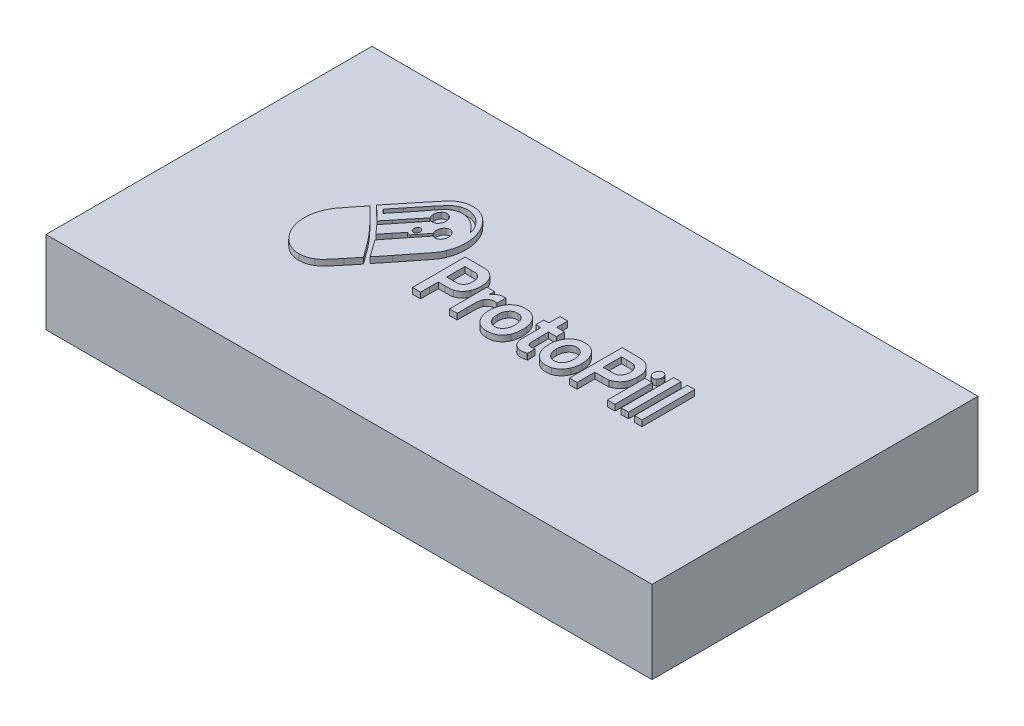
from build123d import *

# Parameters (mm, degrees)
SKETCH1_W           = 308.387151948
SKETCH1_H           = 165.840381384
BOSS_EXTRUDE1_DEPTH = 42
BOSS_EXTRUDE2_DEPTH = 3


with BuildPart() as part:
    # Sketch1 → Boss-Extrude1 (new body)
    with BuildSketch(Plane(origin=(0, 0, 0), x_dir=(1, 0, 0), z_dir=(0, 1, 0))):
        Rectangle(SKETCH1_W, SKETCH1_H)
    extrude(amount=BOSS_EXTRUDE1_DEPTH)

    # Sketch5 → Boss-Extrude2 (add)
    # profile 1 of 13: a face of its own
    with BuildSketch(Plane(origin=(0, 42, 0), x_dir=(1, 0, 0), z_dir=(0, 1, 0))):
        with BuildLine():
            add(Edge.make_bspline(
                [(-70.434889142, 22.994330596), (-74.068365142, 18.491741596), (-77.713638142, 13.989151596), (-78.539428142, 12.987008596)],
                knots=[0, 0, 0, 0, 1, 1, 1, 1], degree=3))
            Line((-78.539428142, 12.987008596), (-80.037647142, 11.137982596))
            Line((-80.037647142, 11.137982596), (-78.126533142, 9.303071596))
            add(Edge.make_bspline(
                [(-78.126533142, 9.303071596), (-77.076600142, 8.300927596), (-75.507599142, 6.762425596), (-74.634621142, 5.887313596)],
                knots=[0, 0, 0, 0, 1, 1, 1, 1], degree=3))
            add(Edge.make_bspline(
                [(-74.634621142, 5.887313596), (-73.761643142, 5.012202596), (-72.994838142, 4.320582596), (-72.924056142, 4.334696596)],
                knots=[0, 0, 0, 0, 1, 1, 1, 1], degree=3))
            add(Edge.make_bspline(
                [(-72.924056142, 4.334696596), (-72.841477142, 4.362926596), (-71.284273142, 6.254296596), (-69.443941142, 8.540877596)],
                knots=[0, 0, 0, 0, 1, 1, 1, 1], degree=3))
            add(Edge.make_bspline(
                [(-69.443941142, 8.540877596), (-67.591812142, 10.827458596), (-64.902096142, 14.144413596), (-63.439268142, 15.894636596)],
                knots=[0, 0, 0, 0, 1, 1, 1, 1], degree=3))
            Line((-63.439268142, 15.894636596), (-60.796740142, 19.084558596))
            Line((-60.796740142, 19.084558596), (-61.127056142, 19.776178596))
            add(Edge.make_bspline(
                [(-61.127056142, 19.776178596), (-61.421981142, 20.383110596), (-61.469169142, 20.608946596), (-61.469169142, 21.596975596)],
                knots=[0, 0, 0, 0, 1, 1, 1, 1], degree=3))
            add(Edge.make_bspline(
                [(-61.469169142, 21.596975596), (-61.469169142, 22.923756596), (-61.233229142, 23.573033596), (-60.466424142, 24.405800596)],
                knots=[0, 0, 0, 0, 1, 1, 1, 1], degree=3))
            add(Edge.make_bspline(
                [(-60.466424142, 24.405800596), (-59.805792142, 25.125650596), (-59.251333142, 25.379714596), (-58.401949142, 25.379714596)],
                knots=[0, 0, 0, 0, 1, 1, 1, 1], degree=3))
            add(Edge.make_bspline(
                [(-58.401949142, 25.379714596), (-57.517174142, 25.393829596), (-56.797557142, 25.026847596), (-56.136925142, 24.222309596)],
                knots=[0, 0, 0, 0, 1, 1, 1, 1], degree=3))
            add(Edge.make_bspline(
                [(-56.136925142, 24.222309596), (-55.452699142, 23.389541596), (-55.228556142, 22.641462596), (-55.299338142, 21.314681596)],
                knots=[0, 0, 0, 0, 1, 1, 1, 1], degree=3))
            add(Edge.make_bspline(
                [(-55.299338142, 21.314681596), (-55.346526142, 20.467799596), (-55.417308142, 20.143160596), (-55.688639142, 19.677375596)],
                knots=[0, 0, 0, 0, 1, 1, 1, 1], degree=3))
            add(Edge.make_bspline(
                [(-55.688639142, 19.677375596), (-56.396459142, 18.378823596), (-57.210452142, 17.828350596), (-58.401949142, 17.842464596)],
                knots=[0, 0, 0, 0, 1, 1, 1, 1], degree=3))
            Line((-58.401949142, 17.842464596), (-59.145160142, 17.842464596))
            Line((-59.145160142, 17.842464596), (-60.666973142, 15.922865596))
            add(Edge.make_bspline(
                [(-60.666973142, 15.922865596), (-61.492763142, 14.864263596), (-64.229667142, 11.448505596), (-66.742428142, 8.343271596)],
                knots=[0, 0, 0, 0, 1, 1, 1, 1], degree=3))
            add(Edge.make_bspline(
                [(-66.742428142, 8.343271596), (-69.266986142, 5.238037596), (-71.319664142, 2.655047596), (-71.319664142, 2.612703596)],
                knots=[0, 0, 0, 0, 1, 1, 1, 1], degree=3))
            add(Edge.make_bspline(
                [(-71.319664142, 2.612703596), (-71.319664142, 2.556244596), (-70.706220142, 1.836394596), (-69.951212142, 1.003627596)],
                knots=[0, 0, 0, 0, 1, 1, 1, 1], degree=3))
            Line((-69.951212142, 1.003627596), (-68.570963142, -0.534874404))
            Line((-68.570963142, -0.534874404), (-67.308684142, -1.889885404))
            add(Edge.make_bspline(
                [(-63.757787142, 2.612703596), (-65.704292142, 0.184975596), (-67.308684142, -1.833426404), (-67.308684142, -1.889885404)],
                knots=[0, 0, 0, 0, 1, 1, 1, 1], degree=3))
            add(Edge.make_bspline(
                [(-60.006341142, 6.917687596), (-60.147905142, 6.974145596), (-61.138853142, 5.844969596), (-63.757787142, 2.612703596)],
                knots=[0, 0, 0, 0, 1, 1, 1, 1], degree=3))
            add(Edge.make_bspline(
                [(-59.133363142, 6.649507596), (-59.510867142, 6.748310596), (-59.900168142, 6.861228596), (-60.006341142, 6.917687596)],
                knots=[0, 0, 0, 0, 1, 1, 1, 1], degree=3))
            Line((-59.133363142, 6.649507596), (-58.449137142, 6.480131596))
            Line((-58.449137142, 6.480131596), (-55.570669142, 10.065265596))
            Line((-55.570669142, 10.065265596), (-54.402766142, 11.561423596))
            Line((-54.402766142, 11.561423596), (-53.246660142, 13.071696596))
            Line((-53.246660142, 13.071696596), (-53.494397142, 13.763316596))
            add(Edge.make_bspline(
                [(-53.494397142, 13.763316596), (-54.143232142, 15.569998596), (-53.541585142, 17.673088596), (-52.102351142, 18.604658596)],
                knots=[0, 0, 0, 0, 1, 1, 1, 1], degree=3))
            add(Edge.make_bspline(
                [(-52.102351142, 18.604658596), (-50.875463142, 19.409196596), (-49.577793142, 19.197476596), (-48.527860142, 18.040070596)],
                knots=[0, 0, 0, 0, 1, 1, 1, 1], degree=3))
            add(Edge.make_bspline(
                [(-48.527860142, 18.040070596), (-46.864483142, 16.162815596), (-47.395348142, 12.789402596), (-49.542402142, 11.716684596)],
                knots=[0, 0, 0, 0, 1, 1, 1, 1], degree=3))
            add(Edge.make_bspline(
                [(-49.542402142, 11.716684596), (-50.037876142, 11.462620596), (-51.005230142, 11.448505596), (-51.618674142, 11.660226596)],
                knots=[0, 0, 0, 0, 1, 1, 1, 1], degree=3))
            Line((-51.618674142, 11.660226596), (-52.055163142, 11.815487596))
            Line((-52.055163142, 11.815487596), (-53.057908142, 10.573394596))
            add(Edge.make_bspline(
                [(-53.057908142, 10.573394596), (-53.966277142, 9.430103596), (-57.493580142, 4.983973596), (-62.967388142, -1.889885404)],
                knots=[0, 0, 0, 0, 1, 1, 1, 1], degree=3))
            add(Edge.make_bspline(
                [(-62.967388142, -1.889885404), (-64.123494142, -3.329585404), (-65.067254142, -4.571678404), (-65.067254142, -4.628137404)],
                knots=[0, 0, 0, 0, 1, 1, 1, 1], degree=3))
            add(Edge.make_bspline(
                [(-65.067254142, -4.628137404), (-65.067254142, -4.698711404), (-64.359434142, -5.714969404), (-63.498253142, -6.886489404)],
                knots=[0, 0, 0, 0, 1, 1, 1, 1], degree=3))
            add(Edge.make_bspline(
                [(-63.498253142, -6.886489404), (-62.637072142, -8.072124404), (-61.268620142, -9.949379404), (-60.478221142, -11.078555404)],
                knots=[0, 0, 0, 0, 1, 1, 1, 1], degree=3))
            add(Edge.make_bspline(
                [(-60.478221142, -11.078555404), (-59.676025142, -12.207731404), (-58.980002142, -13.167531404), (-58.944611142, -13.223989404)],
                knots=[0, 0, 0, 0, 1, 1, 1, 1], degree=3))
            add(Edge.make_bspline(
                [(-58.944611142, -13.223989404), (-58.897423142, -13.294563404), (-56.573414142, -10.457508404), (-53.789322142, -6.942948404)],
                knots=[0, 0, 0, 0, 1, 1, 1, 1], degree=3))
            add(Edge.make_bspline(
                [(-53.789322142, -6.942948404), (-42.983270142, 6.635393596), (-43.348977142, 6.127263596), (-42.192871142, 8.921974596)],
                knots=[0, 0, 0, 0, 1, 1, 1, 1], degree=3))
            add(Edge.make_bspline(
                [(-42.192871142, 8.921974596), (-39.703704142, 14.892492596), (-40.069411142, 21.653433596), (-43.195616142, 27.412231596)],
                knots=[0, 0, 0, 0, 1, 1, 1, 1], degree=3))
            add(Edge.make_bspline(
                [(-43.195616142, 27.412231596), (-44.363519142, 29.571780596), (-46.569558142, 31.985394596), (-48.445281142, 33.171028596)],
                knots=[0, 0, 0, 0, 1, 1, 1, 1], degree=3))
            add(Edge.make_bspline(
                [(-48.445281142, 33.171028596), (-49.483417142, 33.820305596), (-51.429922142, 34.582498596), (-52.727592142, 34.864793596)],
                knots=[0, 0, 0, 0, 1, 1, 1, 1], degree=3))
            add(Edge.make_bspline(
                [(-52.727592142, 34.864793596), (-54.001668142, 35.118857596), (-55.948173142, 35.118857596), (-57.222249142, 34.836563596)],
                knots=[0, 0, 0, 0, 1, 1, 1, 1], degree=3))
            add(Edge.make_bspline(
                [(-57.222249142, 34.836563596), (-59.227739142, 34.413122596), (-61.528154142, 33.227487596), (-63.061764142, 31.844247596)],
                knots=[0, 0, 0, 0, 1, 1, 1, 1], degree=3))
            add(Edge.make_bspline(
                [(-63.061764142, 31.844247596), (-63.486456142, 31.463150596), (-66.801413142, 27.482804596), (-70.434889142, 22.994330596)],
                knots=[0, 0, 0, 0, 1, 1, 1, 1], degree=3))
        make_face()
        with BuildLine():
            add(Edge.make_bspline(
                [(-57.859287142, 11.886061596), (-58.354761142, 12.281273596), (-58.980002142, 12.309502596), (-59.487273142, 11.928405596)],
                knots=[0, 0, 0, 0, 1, 1, 1, 1], degree=3))
            add(Edge.make_bspline(
                [(-57.163264142, 10.305214596), (-57.163264142, 11.039179596), (-57.363813142, 11.490849596), (-57.859287142, 11.886061596)],
                knots=[0, 0, 0, 0, 1, 1, 1, 1], degree=3))
            add(Edge.make_bspline(
                [(-59.345709142, 8.625565596), (-58.331167142, 8.046862596), (-57.163264142, 8.950203596), (-57.163264142, 10.305214596)],
                knots=[0, 0, 0, 0, 1, 1, 1, 1], degree=3))
            add(Edge.make_bspline(
                [(-59.487273142, 11.928405596), (-60.537206142, 11.166211596), (-60.454627142, 9.246612596), (-59.345709142, 8.625565596)],
                knots=[0, 0, 0, 0, 1, 1, 1, 1], degree=3))
        make_face(mode=Mode.SUBTRACT)
        with BuildLine():
            add(Edge.make_bspline(
                [(-63.628020142, 23.050789596), (-65.491946142, 20.510143596), (-66.612661142, 19.098673596), (-72.463973142, 11.886061596)],
                knots=[0, 0, 0, 0, 1, 1, 1, 1], degree=3))
            Line((-72.463973142, 11.886061596), (-74.728997142, 9.077236596))
            Line((-74.728997142, 9.077236596), (-75.625569142, 10.051150596))
            add(Edge.make_bspline(
                [(-75.625569142, 10.051150596), (-76.109246142, 10.573394596), (-76.510344142, 11.039179596), (-76.510344142, 11.081523596)],
                knots=[0, 0, 0, 0, 1, 1, 1, 1], degree=3))
            add(Edge.make_bspline(
                [(-76.510344142, 11.081523596), (-76.510344142, 11.123867596), (-74.481260142, 13.650398596), (-71.992093142, 16.670944596)],
                knots=[0, 0, 0, 0, 1, 1, 1, 1], degree=3))
            add(Edge.make_bspline(
                [(-71.992093142, 16.670944596), (-69.514723142, 19.705605596), (-66.317736142, 23.629491596), (-64.890299142, 25.393829596)],
                knots=[0, 0, 0, 0, 1, 1, 1, 1], degree=3))
            add(Edge.make_bspline(
                [(-64.890299142, 25.393829596), (-61.563545142, 29.515321596), (-60.537206142, 30.461006596), (-58.342964142, 31.420806596)],
                knots=[0, 0, 0, 0, 1, 1, 1, 1], degree=3))
            add(Edge.make_bspline(
                [(-58.342964142, 31.420806596), (-56.420053142, 32.253573596), (-54.390969142, 32.422949596), (-52.267509142, 31.900705596)],
                knots=[0, 0, 0, 0, 1, 1, 1, 1], degree=3))
            add(Edge.make_bspline(
                [(-52.267509142, 31.900705596), (-49.719357142, 31.265544596), (-47.442536142, 29.557665596), (-45.696580142, 26.932331596)],
                knots=[0, 0, 0, 0, 1, 1, 1, 1], degree=3))
            add(Edge.make_bspline(
                [(-45.696580142, 26.932331596), (-44.764617142, 25.534976596), (-43.785466142, 23.079018596), (-44.151173142, 23.079018596)],
                knots=[0, 0, 0, 0, 1, 1, 1, 1], degree=3))
            add(Edge.make_bspline(
                [(-44.151173142, 23.079018596), (-44.198361142, 23.079018596), (-44.717429142, 23.671835596), (-45.319076142, 24.405800596)],
                knots=[0, 0, 0, 0, 1, 1, 1, 1], degree=3))
            add(Edge.make_bspline(
                [(-45.319076142, 24.405800596), (-48.575048142, 28.357916596), (-53.057908142, 30.079909596), (-56.986309142, 28.866045596)],
                knots=[0, 0, 0, 0, 1, 1, 1, 1], degree=3))
            add(Edge.make_bspline(
                [(-56.986309142, 28.866045596), (-58.236791142, 28.484948596), (-59.888371142, 27.496919596), (-60.843928142, 26.537120596)],
                knots=[0, 0, 0, 0, 1, 1, 1, 1], degree=3))
            add(Edge.make_bspline(
                [(-60.843928142, 26.537120596), (-61.280417142, 26.113679596), (-62.530899142, 24.546947596), (-63.628020142, 23.050789596)],
                knots=[0, 0, 0, 0, 1, 1, 1, 1], degree=3))
        make_face(mode=Mode.SUBTRACT)
    # profile 2 of 13: a face of its own
    with BuildSketch(Plane(origin=(0, 42, 0), x_dir=(1, 0, 0), z_dir=(0, 1, 0))):
        with BuildLine():
            Line((-34.630994142, 10.799229596), (-34.630994142, -2.609735404))
            Line((-34.630994142, -2.609735404), (-34.630994142, -16.018700404))
            Line((-34.630994142, -16.018700404), (-32.566519142, -16.018700404))
            Line((-32.566519142, -16.018700404), (-30.502044142, -16.018700404))
            Line((-30.502044142, -16.018700404), (-30.478450142, -11.530225404))
            Line((-30.478450142, -11.530225404), (-30.443059142, -7.055865404))
            Line((-30.443059142, -7.055865404), (-27.139899142, -7.041751404))
            add(Edge.make_bspline(
                [(-27.139899142, -7.041751404), (-24.167055142, -7.027636404), (-23.742363142, -6.999407404), (-22.916573142, -6.731227404)],
                knots=[0, 0, 0, 0, 1, 1, 1, 1], degree=3))
            add(Edge.make_bspline(
                [(-22.916573142, -6.731227404), (-20.887489142, -6.067836404), (-19.353879142, -4.599908404), (-18.480901142, -2.468588404)],
                knots=[0, 0, 0, 0, 1, 1, 1, 1], degree=3))
            add(Edge.make_bspline(
                [(-18.480901142, -2.468588404), (-17.820269142, -0.845397404), (-17.607923142, 0.439039596), (-17.678705142, 2.400983596)],
                knots=[0, 0, 0, 0, 1, 1, 1, 1], degree=3))
            add(Edge.make_bspline(
                [(-17.678705142, 2.400983596), (-17.808472142, 5.915543596), (-19.129736142, 8.498533596), (-21.477339142, 9.895888596)],
                knots=[0, 0, 0, 0, 1, 1, 1, 1], degree=3))
            add(Edge.make_bspline(
                [(-21.477339142, 9.895888596), (-22.928370142, 10.742770596), (-23.341265142, 10.799229596), (-29.286953142, 10.799229596)],
                knots=[0, 0, 0, 0, 1, 1, 1, 1], degree=3))
            Line((-29.286953142, 10.799229596), (-34.630994142, 10.799229596))
        make_face()
        with BuildLine():
            add(Edge.make_bspline(
                [(-22.078986142, -0.224351404), (-22.444693142, -1.155921404), (-22.999152142, -1.833426404), (-23.754160142, -2.285097404)],
                knots=[0, 0, 0, 0, 1, 1, 1, 1], degree=3))
            Line((-23.754160142, -2.285097404), (-24.426589142, -2.680309404))
            Line((-24.426589142, -2.680309404), (-27.458418142, -2.722653404))
            Line((-27.458418142, -2.722653404), (-30.502044142, -2.764997404))
            Line((-30.502044142, -2.764997404), (-30.502044142, 1.906968596))
            Line((-30.502044142, 1.906968596), (-30.502044142, 6.593048596))
            Line((-30.502044142, 6.593048596), (-27.517403142, 6.536590596))
            add(Edge.make_bspline(
                [(-27.517403142, 6.536590596), (-25.051830142, 6.480131596), (-24.450183142, 6.437787596), (-24.001897142, 6.226066596)],
                knots=[0, 0, 0, 0, 1, 1, 1, 1], degree=3))
            add(Edge.make_bspline(
                [(-24.001897142, 6.226066596), (-23.258686142, 5.901428596), (-22.539069142, 5.125120596), (-22.149768142, 4.250008596)],
                knots=[0, 0, 0, 0, 1, 1, 1, 1], degree=3))
            add(Edge.make_bspline(
                [(-22.149768142, 4.250008596), (-21.854843142, 3.600732596), (-21.831249142, 3.389011596), (-21.831249142, 1.977541596)],
                knots=[0, 0, 0, 0, 1, 1, 1, 1], degree=3))
            add(Edge.make_bspline(
                [(-21.831249142, 1.977541596), (-21.831249142, 0.693104596), (-21.878437142, 0.312007596), (-22.078986142, -0.224351404)],
                knots=[0, 0, 0, 0, 1, 1, 1, 1], degree=3))
        make_face(mode=Mode.SUBTRACT)
    # profile 3 of 13: a face of its own
    with BuildSketch(Plane(origin=(0, 42, 0), x_dir=(1, 0, 0), z_dir=(0, 1, 0))):
        with BuildLine():
            Line((45.234695858, 10.813344596), (45.234695858, -2.595620404))
            Line((45.234695858, -2.595620404), (45.234695858, -16.018700404))
            Line((45.234695858, -16.018700404), (47.181200858, -16.018700404))
            Line((47.181200858, -16.018700404), (49.127705858, -16.018700404))
            Line((49.127705858, -16.018700404), (49.127705858, -11.516111404))
            Line((49.127705858, -11.516111404), (49.127705858, -7.013521404))
            Line((49.127705858, -7.013521404), (52.643211858, -6.957063404))
            Line((52.643211858, -6.957063404), (56.146920858, -6.900604404))
            Line((56.146920858, -6.900604404), (57.255838858, -6.448933404))
            add(Edge.make_bspline(
                [(57.255838858, -6.448933404), (60.464622858, -5.122152404), (62.151593858, -2.214523404), (62.151593858, 1.977541596)],
                knots=[0, 0, 0, 0, 1, 1, 1, 1], degree=3))
            add(Edge.make_bspline(
                [(62.151593858, 1.977541596), (62.151593858, 4.631105596), (61.490961858, 6.593048596), (60.051727858, 8.230354596)],
                knots=[0, 0, 0, 0, 1, 1, 1, 1], degree=3))
            add(Edge.make_bspline(
                [(60.051727858, 8.230354596), (59.072576858, 9.331300596), (58.117019858, 9.980576596), (56.831146858, 10.404017596)],
                knots=[0, 0, 0, 0, 1, 1, 1, 1], degree=3))
            add(Edge.make_bspline(
                [(56.831146858, 10.404017596), (55.958168858, 10.700426596), (55.604258858, 10.714541596), (50.578736858, 10.771000596)],
                knots=[0, 0, 0, 0, 1, 1, 1, 1], degree=3))
            Line((50.578736858, 10.771000596), (45.234695858, 10.813344596))
        make_face()
        with BuildLine():
            add(Edge.make_bspline(
                [(56.052544858, -2.341556404), (55.462694858, -2.666194404), (55.297536858, -2.680309404), (52.289301858, -2.722653404)],
                knots=[0, 0, 0, 0, 1, 1, 1, 1], degree=3))
            Line((52.289301858, -2.722653404), (49.127705858, -2.764997404))
            Line((49.127705858, -2.764997404), (49.127705858, 1.892853596))
            Line((49.127705858, 1.892853596), (49.127705858, 6.564819596))
            Line((49.127705858, 6.564819596), (51.746639858, 6.564819596))
            add(Edge.make_bspline(
                [(51.746639858, 6.564819596), (53.185873858, 6.564819596), (54.695889858, 6.494246596), (55.096987858, 6.409557596)],
                knots=[0, 0, 0, 0, 1, 1, 1, 1], degree=3))
            add(Edge.make_bspline(
                [(55.096987858, 6.409557596), (56.571612858, 6.099034596), (57.668733858, 4.913399596), (58.034440858, 3.247865596)],
                knots=[0, 0, 0, 0, 1, 1, 1, 1], degree=3))
            add(Edge.make_bspline(
                [(58.034440858, 3.247865596), (58.270380858, 2.118689596), (58.258583858, 1.412954596), (57.963658858, 0.283777596)],
                knots=[0, 0, 0, 0, 1, 1, 1, 1], degree=3))
            add(Edge.make_bspline(
                [(57.963658858, 0.283777596), (57.668733858, -0.887742404), (56.960913858, -1.861656404), (56.052544858, -2.341556404)],
                knots=[0, 0, 0, 0, 1, 1, 1, 1], degree=3))
        make_face(mode=Mode.SUBTRACT)
    # profile 4 of 13: a face of its own
    with BuildSketch(Plane(origin=(0, 42, 0), x_dir=(1, 0, 0), z_dir=(0, 1, 0))):
        with BuildLine():
            add(Edge.make_bspline(
                [(73.783435858, 10.714541596), (72.969442858, 10.728656596), (72.131855858, 10.714541596), (71.931306858, 10.686311596)],
                knots=[0, 0, 0, 0, 1, 1, 1, 1], degree=3))
            Line((71.931306858, 10.686311596), (71.542005858, 10.643967596))
            Line((71.542005858, 10.643967596), (71.542005858, -2.694423404))
            Line((71.542005858, -2.694423404), (71.542005858, -16.032815404))
            Line((71.542005858, -16.032815404), (73.405931858, -15.990471404))
            Line((73.405931858, -15.990471404), (75.258060858, -15.948126404))
            Line((75.258060858, -15.948126404), (75.258060858, -2.623850404))
            Line((75.258060858, -2.623850404), (75.258060858, 10.700426596))
            Line((75.258060858, 10.700426596), (73.783435858, 10.714541596))
        make_face()
    # profile 5 of 13: a face of its own
    with BuildSketch(Plane(origin=(0, 42, 0), x_dir=(1, 0, 0), z_dir=(0, 1, 0))):
        with BuildLine():
            add(Edge.make_bspline(
                [(78.455047858, 10.686311596), (78.419656858, 10.643967596), (78.384265858, 4.616990596), (78.384265858, -2.708538404)],
                knots=[0, 0, 0, 0, 1, 1, 1, 1], degree=3))
            Line((78.384265858, -2.708538404), (78.384265858, -16.018700404))
            Line((78.384265858, -16.018700404), (80.271785858, -16.018700404))
            Line((80.271785858, -16.018700404), (82.159305858, -16.018700404))
            Line((82.159305858, -16.018700404), (82.159305858, -2.609735404))
            Line((82.159305858, -2.609735404), (82.159305858, 10.813344596))
            Line((82.159305858, 10.813344596), (80.342567858, 10.785114596))
            add(Edge.make_bspline(
                [(80.342567858, 10.785114596), (79.339822858, 10.785114596), (78.490438858, 10.742770596), (78.455047858, 10.686311596)],
                knots=[0, 0, 0, 0, 1, 1, 1, 1], degree=3))
        make_face()
    # profile 6 of 13: a face of its own
    with BuildSketch(Plane(origin=(0, 42, 0), x_dir=(1, 0, 0), z_dir=(0, 1, 0))):
        with BuildLine():
            add(Edge.make_bspline(
                [(-72.074672142, -28.213801404), (-70.175355142, -27.056395404), (-69.420347142, -26.265972404), (-64.784126142, -20.605978404)],
                knots=[0, 0, 0, 0, 1, 1, 1, 1], degree=3))
            Line((-64.784126142, -20.605978404), (-60.372048142, -15.228277404))
            Line((-60.372048142, -15.228277404), (-61.681515142, -13.393366404))
            add(Edge.make_bspline(
                [(-61.681515142, -13.393366404), (-66.058202142, -7.267586404), (-68.146271142, -4.628137404), (-71.673574142, -0.774824404)],
                knots=[0, 0, 0, 0, 1, 1, 1, 1], degree=3))
            add(Edge.make_bspline(
                [(-71.673574142, -0.774824404), (-74.752591142, 2.598588596), (-80.934219142, 8.893745596), (-81.347114142, 9.077236596)],
                knots=[0, 0, 0, 0, 1, 1, 1, 1], degree=3))
            add(Edge.make_bspline(
                [(-81.347114142, 9.077236596), (-81.394302142, 9.091350596), (-83.069476142, 7.044719596), (-85.074966142, 4.504073596)],
                knots=[0, 0, 0, 0, 1, 1, 1, 1], degree=3))
            add(Edge.make_bspline(
                [(-85.074966142, 4.504073596), (-87.080456142, 1.963427596), (-88.944382142, -0.436071404), (-89.227510142, -0.831283404)],
                knots=[0, 0, 0, 0, 1, 1, 1, 1], degree=3))
            add(Edge.make_bspline(
                [(-89.227510142, -0.831283404), (-90.430804142, -2.539161404), (-91.634098142, -5.192725404), (-92.259339142, -7.479306404)],
                knots=[0, 0, 0, 0, 1, 1, 1, 1], degree=3))
            add(Edge.make_bspline(
                [(-92.259339142, -7.479306404), (-93.144114142, -10.753917404), (-93.120520142, -14.720148404), (-92.200354142, -18.022987404)],
                knots=[0, 0, 0, 0, 1, 1, 1, 1], degree=3))
            add(Edge.make_bspline(
                [(-92.200354142, -18.022987404), (-91.492534142, -20.563633404), (-90.466195142, -22.567921404), (-88.861803142, -24.572208404)],
                knots=[0, 0, 0, 0, 1, 1, 1, 1], degree=3))
            add(Edge.make_bspline(
                [(-88.861803142, -24.572208404), (-85.900756142, -28.284374404), (-82.491423142, -30.048712404), (-78.338879142, -30.034597404)],
                knots=[0, 0, 0, 0, 1, 1, 1, 1], degree=3))
            add(Edge.make_bspline(
                [(-78.338879142, -30.034597404), (-75.991276142, -30.020482404), (-74.174538142, -29.498238404), (-72.074672142, -28.213801404)],
                knots=[0, 0, 0, 0, 1, 1, 1, 1], degree=3))
        make_face()
        with BuildLine():
            add(Edge.make_bspline(
                [(-89.310089142, -4.924546404), (-88.673051142, -3.583649404), (-88.047810142, -2.694423404), (-84.532304142, 1.709362596)],
                knots=[0, 0, 0, 0, 1, 1, 1, 1], degree=3))
            Line((-84.532304142, 1.709362596), (-81.311723142, 5.746166596))
            Line((-81.311723142, 5.746166596), (-80.391557142, 4.645220596))
            Line((-80.391557142, 4.645220596), (-79.471391142, 3.558388596))
            Line((-79.471391142, 3.558388596), (-80.202805142, 2.598588596))
            add(Edge.make_bspline(
                [(-80.202805142, 2.598588596), (-80.603903142, 2.076344596), (-81.842588142, 0.481383596), (-82.963303142, -0.944200404)],
                knots=[0, 0, 0, 0, 1, 1, 1, 1], degree=3))
            add(Edge.make_bspline(
                [(-82.963303142, -0.944200404), (-84.072221142, -2.369785404), (-85.358094142, -4.063549404), (-85.806380142, -4.712825404)],
                knots=[0, 0, 0, 0, 1, 1, 1, 1], degree=3))
            add(Edge.make_bspline(
                [(-85.806380142, -4.712825404), (-87.800073142, -7.592224404), (-88.873600142, -10.711573404), (-89.097743142, -14.324936404)],
                knots=[0, 0, 0, 0, 1, 1, 1, 1], degree=3))
            add(Edge.make_bspline(
                [(-89.097743142, -14.324936404), (-89.192119142, -15.764635404), (-89.203916142, -15.806979404), (-89.475247142, -15.806979404)],
                knots=[0, 0, 0, 0, 1, 1, 1, 1], degree=3))
            add(Edge.make_bspline(
                [(-89.475247142, -15.806979404), (-89.722984142, -15.806979404), (-89.817360142, -15.679947404), (-90.029706142, -15.030671404)],
                knots=[0, 0, 0, 0, 1, 1, 1, 1], degree=3))
            add(Edge.make_bspline(
                [(-90.029706142, -15.030671404), (-90.395413142, -13.943839404), (-90.666744142, -12.264190404), (-90.666744142, -11.106784404)],
                knots=[0, 0, 0, 0, 1, 1, 1, 1], degree=3))
            add(Edge.make_bspline(
                [(-90.666744142, -11.106784404), (-90.666744142, -9.187185404), (-90.100488142, -6.618310404), (-89.310089142, -4.924546404)],
                knots=[0, 0, 0, 0, 1, 1, 1, 1], degree=3))
        make_face(mode=Mode.SUBTRACT)
    # profile 7 of 13: a face of its own
    with BuildSketch(Plane(origin=(0, 42, 0), x_dir=(1, 0, 0), z_dir=(0, 1, 0))):
        with BuildLine():
            Line((-81.311723142, 5.746166596), (-84.532304142, 1.709362596))
            add(Edge.make_bspline(
                [(-89.310089142, -4.924546404), (-88.673051142, -3.583649404), (-88.047810142, -2.694423404), (-84.532304142, 1.709362596)],
                knots=[0, 0, 0, 0, 1, 1, 1, 1], degree=3))
            add(Edge.make_bspline(
                [(-90.666744142, -11.106784404), (-90.666744142, -9.187185404), (-90.100488142, -6.618310404), (-89.310089142, -4.924546404)],
                knots=[0, 0, 0, 0, 1, 1, 1, 1], degree=3))
            add(Edge.make_bspline(
                [(-90.029706142, -15.030671404), (-90.395413142, -13.943839404), (-90.666744142, -12.264190404), (-90.666744142, -11.106784404)],
                knots=[0, 0, 0, 0, 1, 1, 1, 1], degree=3))
            add(Edge.make_bspline(
                [(-89.475247142, -15.806979404), (-89.722984142, -15.806979404), (-89.817360142, -15.679947404), (-90.029706142, -15.030671404)],
                knots=[0, 0, 0, 0, 1, 1, 1, 1], degree=3))
            add(Edge.make_bspline(
                [(-89.097743142, -14.324936404), (-89.192119142, -15.764635404), (-89.203916142, -15.806979404), (-89.475247142, -15.806979404)],
                knots=[0, 0, 0, 0, 1, 1, 1, 1], degree=3))
            add(Edge.make_bspline(
                [(-85.806380142, -4.712825404), (-87.800073142, -7.592224404), (-88.873600142, -10.711573404), (-89.097743142, -14.324936404)],
                knots=[0, 0, 0, 0, 1, 1, 1, 1], degree=3))
            add(Edge.make_bspline(
                [(-82.963303142, -0.944200404), (-84.072221142, -2.369785404), (-85.358094142, -4.063549404), (-85.806380142, -4.712825404)],
                knots=[0, 0, 0, 0, 1, 1, 1, 1], degree=3))
            add(Edge.make_bspline(
                [(-80.202805142, 2.598588596), (-80.603903142, 2.076344596), (-81.842588142, 0.481383596), (-82.963303142, -0.944200404)],
                knots=[0, 0, 0, 0, 1, 1, 1, 1], degree=3))
            Line((-80.202805142, 2.598588596), (-79.471391142, 3.558388596))
            Line((-79.471391142, 3.558388596), (-80.391557142, 4.645220596))
            Line((-80.391557142, 4.645220596), (-81.311723142, 5.746166596))
        make_face()
    # profile 8 of 13: a face of its own
    with BuildSketch(Plane(origin=(0, 42, 0), x_dir=(1, 0, 0), z_dir=(0, 1, 0))):
        with BuildLine():
            Line((15.742195858, 8.682024596), (15.718601858, 5.901428596))
            Line((15.718601858, 5.901428596), (15.683210858, 3.106718596))
            Line((15.683210858, 3.106718596), (14.409134858, 3.064373596))
            Line((14.409134858, 3.064373596), (13.135058858, 3.022029596))
            Line((13.135058858, 3.022029596), (13.170449858, 1.017742596))
            Line((13.170449858, 1.017742596), (13.205840858, -0.986544404))
            Line((13.205840858, -0.986544404), (14.479916858, -1.028889404))
            Line((14.479916858, -1.028889404), (15.742195858, -1.071233404))
            Line((15.742195858, -1.071233404), (15.742195858, -6.180754404))
            add(Edge.make_bspline(
                [(15.742195858, -6.180754404), (15.742195858, -10.711573404), (15.765789858, -11.403193404), (15.954541858, -12.235960404)],
                knots=[0, 0, 0, 0, 1, 1, 1, 1], degree=3))
            add(Edge.make_bspline(
                [(15.954541858, -12.235960404), (16.497203858, -14.564886404), (17.747685858, -15.821094404), (19.871145858, -16.188076404)],
                knots=[0, 0, 0, 0, 1, 1, 1, 1], degree=3))
            add(Edge.make_bspline(
                [(19.871145858, -16.188076404), (20.873890858, -16.357453404), (22.360312858, -16.216306404), (23.304072858, -15.863438404)],
                knots=[0, 0, 0, 0, 1, 1, 1, 1], degree=3))
            Line((23.304072858, -15.863438404), (23.716967858, -15.708177404))
            Line((23.716967858, -15.708177404), (23.669779858, -13.774463404))
            add(Edge.make_bspline(
                [(23.669779858, -13.774463404), (23.646185858, -12.715860404), (23.610794858, -11.840749404), (23.587200858, -11.812519404)],
                knots=[0, 0, 0, 0, 1, 1, 1, 1], degree=3))
            add(Edge.make_bspline(
                [(23.587200858, -11.812519404), (23.575403858, -11.798405404), (23.256884858, -11.868978404), (22.867583858, -11.996010404)],
                knots=[0, 0, 0, 0, 1, 1, 1, 1], degree=3))
            add(Edge.make_bspline(
                [(22.867583858, -11.996010404), (21.487334858, -12.419452404), (20.496386858, -12.123043404), (19.977318858, -11.135014404)],
                knots=[0, 0, 0, 0, 1, 1, 1, 1], degree=3))
            add(Edge.make_bspline(
                [(19.977318858, -11.135014404), (19.694190858, -10.584540404), (19.694190858, -10.570426404), (19.658799858, -5.813772404)],
                knots=[0, 0, 0, 0, 1, 1, 1, 1], degree=3))
            Line((19.658799858, -5.813772404), (19.623408858, -1.057118404))
            Line((19.623408858, -1.057118404), (21.628898858, -1.057118404))
            Line((21.628898858, -1.057118404), (23.646185858, -1.057118404))
            Line((23.646185858, -1.057118404), (23.646185858, 0.989513596))
            Line((23.646185858, 0.989513596), (23.646185858, 3.036144596))
            Line((23.646185858, 3.036144596), (21.676086858, 3.064373596))
            Line((21.676086858, 3.064373596), (19.694190858, 3.106718596))
            Line((19.694190858, 3.106718596), (19.658799858, 5.901428596))
            Line((19.658799858, 5.901428596), (19.635205858, 8.682024596))
            Line((19.635205858, 8.682024596), (17.688700858, 8.682024596))
            Line((17.688700858, 8.682024596), (15.742195858, 8.682024596))
        make_face()
    # profile 9 of 13: a face of its own
    with BuildSketch(Plane(origin=(0, 42, 0), x_dir=(1, 0, 0), z_dir=(0, 1, 0))):
        with BuildLine():
            add(Edge.make_bspline(
                [(-11.921769142, 0.354351596), (-11.957160142, 0.354351596), (-11.980754142, 0.961283596), (-11.980754142, 1.695248596)],
                knots=[0, 0, 0, 0, 1, 1, 1, 1], degree=3))
            Line((-11.980754142, 1.695248596), (-11.980754142, 3.036144596))
            Line((-11.980754142, 3.036144596), (-13.868274142, 3.036144596))
            Line((-13.868274142, 3.036144596), (-15.755794142, 3.036144596))
            Line((-15.755794142, 3.036144596), (-15.755794142, -6.491278404))
            Line((-15.755794142, -6.491278404), (-15.755794142, -16.018700404))
            Line((-15.755794142, -16.018700404), (-13.809289142, -16.018700404))
            Line((-13.809289142, -16.018700404), (-11.862784142, -16.018700404))
            Line((-11.862784142, -16.018700404), (-11.862784142, -11.036211404))
            add(Edge.make_bspline(
                [(-11.862784142, -11.036211404), (-11.862784142, -5.630281404), (-11.780205142, -4.656366404), (-11.213949142, -3.527191404)],
                knots=[0, 0, 0, 0, 1, 1, 1, 1], degree=3))
            add(Edge.make_bspline(
                [(-11.213949142, -3.527191404), (-10.399956142, -1.847541404), (-8.441654142, -0.930086404), (-6.636713142, -1.381756404)],
                knots=[0, 0, 0, 0, 1, 1, 1, 1], degree=3))
            Line((-6.636713142, -1.381756404), (-6.200224142, -1.494674404))
            Line((-6.200224142, -1.494674404), (-6.200224142, 0.777792596))
            Line((-6.200224142, 0.777792596), (-6.200224142, 3.036144596))
            Line((-6.200224142, 3.036144596), (-6.483352142, 3.036144596))
            add(Edge.make_bspline(
                [(-6.483352142, 3.036144596), (-6.636713142, 3.036144596), (-6.837262142, 3.064373596), (-6.931638142, 3.092603596)],
                knots=[0, 0, 0, 0, 1, 1, 1, 1], degree=3))
            add(Edge.make_bspline(
                [(-6.931638142, 3.092603596), (-7.014217142, 3.120832596), (-7.427112142, 3.092603596), (-7.851804142, 3.036144596)],
                knots=[0, 0, 0, 0, 1, 1, 1, 1], degree=3))
            add(Edge.make_bspline(
                [(-7.851804142, 3.036144596), (-9.232053142, 2.838538596), (-10.529723142, 2.090459596), (-11.367310142, 1.003627596)],
                knots=[0, 0, 0, 0, 1, 1, 1, 1], degree=3))
            add(Edge.make_bspline(
                [(-11.367310142, 1.003627596), (-11.638641142, 0.650760596), (-11.898175142, 0.354351596), (-11.921769142, 0.354351596)],
                knots=[0, 0, 0, 0, 1, 1, 1, 1], degree=3))
        make_face()
    # profile 10 of 13: a face of its own
    with BuildSketch(Plane(origin=(0, 42, 0), x_dir=(1, 0, 0), z_dir=(0, 1, 0))):
        Polygon((64.581775858, 3.036144596), (64.581775858, -6.491278404), (64.581775858, -16.018700404), (66.469295858, -16.018700404), (68.356815858, -16.018700404), (68.356815858, -6.491278404), (68.356815858, 3.036144596), (66.469295858, 3.036144596), align=None)
    # profile 11 of 13: a face of its own
    with BuildSketch(Plane(origin=(0, 42, 0), x_dir=(1, 0, 0), z_dir=(0, 1, 0))):
        with BuildLine():
            add(Edge.make_bspline(
                [(67.448446858, 10.178182596), (67.011957858, 10.404017596), (66.079994858, 10.418132596), (65.643505858, 10.220526596)],
                knots=[0, 0, 0, 0, 1, 1, 1, 1], degree=3))
            add(Edge.make_bspline(
                [(65.643505858, 10.220526596), (64.452008858, 9.655938596), (63.932940858, 7.778683596), (64.605369858, 6.409557596)],
                knots=[0, 0, 0, 0, 1, 1, 1, 1], degree=3))
            add(Edge.make_bspline(
                [(64.605369858, 6.409557596), (65.053655858, 5.492102596), (65.690693858, 5.111005596), (66.646250858, 5.181578596)],
                knots=[0, 0, 0, 0, 1, 1, 1, 1], degree=3))
            add(Edge.make_bspline(
                [(66.646250858, 5.181578596), (67.271491858, 5.223923596), (67.483837858, 5.308611596), (67.849544858, 5.661478596)],
                knots=[0, 0, 0, 0, 1, 1, 1, 1], degree=3))
            add(Edge.make_bspline(
                [(67.849544858, 5.661478596), (68.427597858, 6.211952596), (68.710725858, 6.889457596), (68.710725858, 7.722224596)],
                knots=[0, 0, 0, 0, 1, 1, 1, 1], degree=3))
            add(Edge.make_bspline(
                [(68.710725858, 7.722224596), (68.710725858, 8.865515596), (68.250642858, 9.768856596), (67.448446858, 10.178182596)],
                knots=[0, 0, 0, 0, 1, 1, 1, 1], degree=3))
        make_face()
    # profile 12 of 13: a face of its own
    with BuildSketch(Plane(origin=(0, 42, 0), x_dir=(1, 0, 0), z_dir=(0, 1, 0))):
        with BuildLine():
            add(Edge.make_bspline(
                [(3.827225858, 3.403126596), (2.647525858, 3.445470596), (1.892517858, 3.389011596), (1.397043858, 3.261979596)],
                knots=[0, 0, 0, 0, 1, 1, 1, 1], degree=3))
            add(Edge.make_bspline(
                [(1.397043858, 3.261979596), (-1.505018142, 2.471556596), (-3.569493142, 0.326122596), (-4.489659142, -2.849685404)],
                knots=[0, 0, 0, 0, 1, 1, 1, 1], degree=3))
            add(Edge.make_bspline(
                [(-4.489659142, -2.849685404), (-5.940690142, -7.832174404), (-4.300907142, -13.195760404), (-0.691025142, -15.312965404)],
                knots=[0, 0, 0, 0, 1, 1, 1, 1], degree=3))
            add(Edge.make_bspline(
                [(-0.691025142, -15.312965404), (0.594847858, -16.061044404), (1.668374858, -16.329223404), (3.414330858, -16.329223404)],
                knots=[0, 0, 0, 0, 1, 1, 1, 1], degree=3))
            add(Edge.make_bspline(
                [(3.414330858, -16.329223404), (7.036009858, -16.343338404), (9.572364858, -14.734262404), (11.011598858, -11.516111404)],
                knots=[0, 0, 0, 0, 1, 1, 1, 1], degree=3))
            add(Edge.make_bspline(
                [(11.011598858, -11.516111404), (11.837388858, -9.652970404), (12.155907858, -6.858260404), (11.801997858, -4.472875404)],
                knots=[0, 0, 0, 0, 1, 1, 1, 1], degree=3))
            add(Edge.make_bspline(
                [(11.801997858, -4.472875404), (11.259335858, -0.732480404), (9.466191858, 1.779936596), (6.516941858, 2.965571596)],
                knots=[0, 0, 0, 0, 1, 1, 1, 1], degree=3))
            add(Edge.make_bspline(
                [(6.516941858, 2.965571596), (5.667557858, 3.304323596), (5.313647858, 3.360782596), (3.827225858, 3.403126596)],
                knots=[0, 0, 0, 0, 1, 1, 1, 1], degree=3))
        make_face()
        with BuildLine():
            add(Edge.make_bspline(
                [(3.650270858, -0.676021404), (4.641218858, -0.704250404), (4.936143858, -0.760709404), (5.502399858, -1.085347404)],
                knots=[0, 0, 0, 0, 1, 1, 1, 1], degree=3))
            add(Edge.make_bspline(
                [(5.502399858, -1.085347404), (6.823663858, -1.819312404), (7.590468858, -3.117864404), (7.932581858, -5.206840404)],
                knots=[0, 0, 0, 0, 1, 1, 1, 1], degree=3))
            add(Edge.make_bspline(
                [(7.932581858, -5.206840404), (8.286491858, -7.366389404), (7.732032858, -9.723544404), (6.564129858, -10.937408404)],
                knots=[0, 0, 0, 0, 1, 1, 1, 1], degree=3))
            add(Edge.make_bspline(
                [(6.564129858, -10.937408404), (5.903497858, -11.643143404), (5.502399858, -11.911322404), (4.712000858, -12.151272404)],
                knots=[0, 0, 0, 0, 1, 1, 1, 1], degree=3))
            add(Edge.make_bspline(
                [(4.712000858, -12.151272404), (2.836277858, -12.758204404), (0.842584858, -11.911322404), (-0.183754142, -10.062297404)],
                knots=[0, 0, 0, 0, 1, 1, 1, 1], degree=3))
            add(Edge.make_bspline(
                [(-0.183754142, -10.062297404), (-0.808995142, -8.933121404), (-1.056732142, -7.902747404), (-1.056732142, -6.420704404)],
                knots=[0, 0, 0, 0, 1, 1, 1, 1], degree=3))
            add(Edge.make_bspline(
                [(-1.056732142, -6.420704404), (-1.056732142, -4.670481404), (-0.714619142, -3.428388404), (0.063982858, -2.412129404)],
                knots=[0, 0, 0, 0, 1, 1, 1, 1], degree=3))
            add(Edge.make_bspline(
                [(0.063982858, -2.412129404), (1.149306858, -0.986544404), (1.904314858, -0.619562404), (3.650270858, -0.676021404)],
                knots=[0, 0, 0, 0, 1, 1, 1, 1], degree=3))
        make_face(mode=Mode.SUBTRACT)
    # profile 13 of 13: a face of its own
    with BuildSketch(Plane(origin=(0, 42, 0), x_dir=(1, 0, 0), z_dir=(0, 1, 0))):
        with BuildLine():
            add(Edge.make_bspline(
                [(33.968560858, 3.403126596), (32.777063858, 3.445470596), (32.092837858, 3.389011596), (31.491190858, 3.233750596)],
                knots=[0, 0, 0, 0, 1, 1, 1, 1], degree=3))
            add(Edge.make_bspline(
                [(31.491190858, 3.233750596), (30.500242858, 2.965571596), (29.249760858, 2.358638596), (28.565534858, 1.779936596)],
                knots=[0, 0, 0, 0, 1, 1, 1, 1], degree=3))
            add(Edge.make_bspline(
                [(28.565534858, 1.779936596), (27.055518858, 0.537842596), (25.757848858, -1.819312404), (25.344953858, -4.077664404)],
                knots=[0, 0, 0, 0, 1, 1, 1, 1], degree=3))
            add(Edge.make_bspline(
                [(25.344953858, -4.077664404), (25.061825858, -5.672625404), (25.156201858, -8.199156404), (25.569096858, -9.737658404)],
                knots=[0, 0, 0, 0, 1, 1, 1, 1], degree=3))
            add(Edge.make_bspline(
                [(25.569096858, -9.737658404), (26.453871858, -12.998154404), (28.553737858, -15.298850404), (31.408611858, -16.103388404)],
                knots=[0, 0, 0, 0, 1, 1, 1, 1], degree=3))
            add(Edge.make_bspline(
                [(31.408611858, -16.103388404), (32.576514858, -16.442141404), (34.888726858, -16.399797404), (36.068426858, -16.032815404)],
                knots=[0, 0, 0, 0, 1, 1, 1, 1], degree=3))
            add(Edge.make_bspline(
                [(36.068426858, -16.032815404), (38.368841858, -15.312965404), (40.161985858, -13.619201404), (41.152933858, -11.205587404)],
                knots=[0, 0, 0, 0, 1, 1, 1, 1], degree=3))
            add(Edge.make_bspline(
                [(41.152933858, -11.205587404), (41.801768858, -9.624741404), (42.049505858, -8.382647404), (42.049505858, -6.533622404)],
                knots=[0, 0, 0, 0, 1, 1, 1, 1], degree=3))
            add(Edge.make_bspline(
                [(42.049505858, -6.533622404), (42.049505858, -4.684596404), (41.801768858, -3.357814404), (41.152933858, -1.776968404)],
                knots=[0, 0, 0, 0, 1, 1, 1, 1], degree=3))
            add(Edge.make_bspline(
                [(41.152933858, -1.776968404), (40.716444858, -0.718365404), (40.421519858, -0.224351404), (39.701902858, 0.636645596)],
                knots=[0, 0, 0, 0, 1, 1, 1, 1], degree=3))
            add(Edge.make_bspline(
                [(39.701902858, 0.636645596), (38.687360858, 1.864624596), (37.932352858, 2.429212596), (36.563900858, 2.979685596)],
                knots=[0, 0, 0, 0, 1, 1, 1, 1], degree=3))
            add(Edge.make_bspline(
                [(36.563900858, 2.979685596), (35.761704858, 3.304323596), (35.384200858, 3.360782596), (33.968560858, 3.403126596)],
                knots=[0, 0, 0, 0, 1, 1, 1, 1], degree=3))
        make_face()
        with BuildLine():
            add(Edge.make_bspline(
                [(33.567462858, -0.506645404), (33.661838858, -0.506645404), (34.062936858, -0.563103404), (34.440440858, -0.647792404)],
                knots=[0, 0, 0, 0, 1, 1, 1, 1], degree=3))
            add(Edge.make_bspline(
                [(34.440440858, -0.647792404), (36.764449858, -1.155921404), (38.156495858, -3.386044404), (38.156495858, -6.575966404)],
                knots=[0, 0, 0, 0, 1, 1, 1, 1], degree=3))
            add(Edge.make_bspline(
                [(38.156495858, -6.575966404), (38.156495858, -10.146985404), (36.080223858, -12.560599404), (33.237146858, -12.306534404)],
                knots=[0, 0, 0, 0, 1, 1, 1, 1], degree=3))
            add(Edge.make_bspline(
                [(33.237146858, -12.306534404), (30.783370858, -12.080699404), (29.072805858, -9.695314404), (29.072805858, -6.505392404)],
                knots=[0, 0, 0, 0, 1, 1, 1, 1], degree=3))
            add(Edge.make_bspline(
                [(29.072805858, -6.505392404), (29.072805858, -3.019061404), (30.759776858, -0.760709404), (33.567462858, -0.506645404)],
                knots=[0, 0, 0, 0, 1, 1, 1, 1], degree=3))
        make_face(mode=Mode.SUBTRACT)
    extrude(amount=BOSS_EXTRUDE2_DEPTH)


solid = part.part
